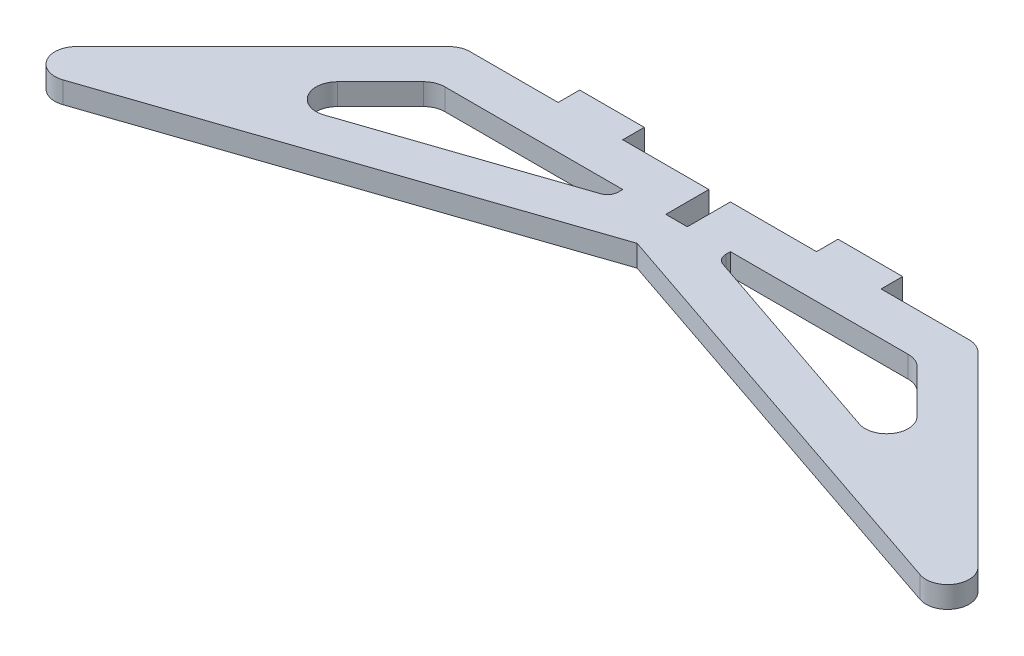
from build123d import *

# Parameters (mm, degrees)
BOSS_EXTRUDE1_DEPTH = 3.175


with BuildPart() as part:
    # Sketch1 → Boss-Extrude1 (new body)
    with BuildSketch(Plane(origin=(0, 0, 0), x_dir=(1, 0, 0), z_dir=(0, 1, 0))):
        with BuildLine():
            Line((-36.784871939, 0), (-23.8125, 0))
            Line((-23.8125, 0), (-23.8125, 3.175))
            Line((-23.8125, 3.175), (-14.2875, 3.175))
            Line((-14.2875, 3.175), (-14.2875, 0))
            Line((-14.2875, 0), (-1.5875, 0))
            Line((-1.5875, 0), (-1.5875, -6.35))
            Line((-1.5875, -6.35), (1.5875, -6.35))
            Line((1.5875, -6.35), (1.5875, 0))
            Line((1.5875, 0), (14.2875, 0))
            Line((14.2875, 0), (14.2875, 3.175))
            Line((14.2875, 3.175), (23.8125, 3.175))
            Line((23.8125, 3.175), (23.8125, 0))
            Line((23.8125, 0), (36.784871939, 0))
            ThreePointArc((36.784871939, 0), (37.999891837, -0.241682484), (39.02993597, -0.92993597))
            Line((39.02993597, -0.92993597), (66.469065694, -28.369065694))
            ThreePointArc((66.469065694, -28.369065694), (66.920159512, -32.290840151), (63.203219493, -33.620560958))
            Line((63.203219493, -33.620560958), (0, -12.160991598))
            Line((0, -12.160991598), (-63.203219493, -33.620560958))
            ThreePointArc((-63.203219493, -33.620560958), (-66.920159512, -32.290840151), (-66.469065694, -28.369065694))
            Line((-66.469065694, -28.369065694), (-39.02993597, -0.92993597))
            ThreePointArc((-39.02993597, -0.92993597), (-37.999891837, -0.241682484), (-36.784871939, 0))
        make_face()
        with BuildLine():
            Line((-39.452913677, -18.850511262), (-9.014608915, -8.515706841))
            ThreePointArc((-9.014608915, -8.515706841), (-8.234573307, -7.9371291), (-7.9375, -7.012491225))
            Line((-7.9375, -7.012491225), (-7.9375, -6.35))
            Line((-7.9375, -6.35), (-34.154615818, -6.35))
            ThreePointArc((-34.154615818, -6.35), (-35.369635716, -6.591682484), (-36.399679849, -7.27993597))
            Line((-36.399679849, -7.27993597), (-42.718759878, -13.599015999))
            ThreePointArc((-42.718759878, -13.599015999), (-43.169853696, -17.520790456), (-39.452913677, -18.850511262))
        make_face(mode=Mode.SUBTRACT)
        with BuildLine():
            Line((39.452913677, -18.850511262), (9.014608915, -8.515706841))
            ThreePointArc((9.014608915, -8.515706841), (8.234573307, -7.9371291), (7.9375, -7.012491225))
            Line((7.9375, -7.012491225), (7.9375, -6.35))
            Line((7.9375, -6.35), (34.154615818, -6.35))
            ThreePointArc((34.154615818, -6.35), (35.369635716, -6.591682484), (36.399679849, -7.27993597))
            Line((36.399679849, -7.27993597), (42.718759878, -13.599015999))
            ThreePointArc((42.718759878, -13.599015999), (43.169853696, -17.520790456), (39.452913677, -18.850511262))
        make_face(mode=Mode.SUBTRACT)
    extrude(amount=BOSS_EXTRUDE1_DEPTH)


solid = part.part
